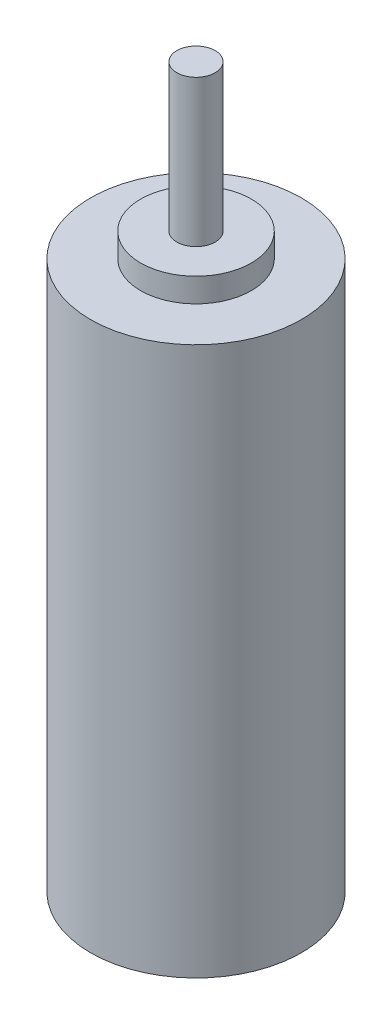
from build123d import *

# Parameters (mm, degrees)
SKETCH1_R           = 11
BOSS_EXTRUDE1_DEPTH = 57.2
SKETCH2_R           = 5.776092572
BOSS_EXTRUDE2_DEPTH = 2.5
SKETCH3_R           = 2
BOSS_EXTRUDE3_DEPTH = 15.3


with BuildPart() as part:
    # Sketch1 → Boss-Extrude1 (new body)
    with BuildSketch(Plane(origin=(0, 0, 0), x_dir=(1, 0, 0), z_dir=(0, 1, 0))):
        with Locations(Location((0, 0, 0), (0, 0, 270))):
            Circle(SKETCH1_R)
    extrude(amount=BOSS_EXTRUDE1_DEPTH)

    # Sketch2 → Boss-Extrude2 (add)
    with BuildSketch(Plane(origin=(0, 57.2, 0), x_dir=(1, 0, 0), z_dir=(0, 1, 0))):
        with Locations(Location((0, 0, 0), (0, 0, 270))):
            Circle(SKETCH2_R)
    extrude(amount=BOSS_EXTRUDE2_DEPTH)

    # Sketch3 → Boss-Extrude3 (add)
    with BuildSketch(Plane(origin=(0, 59.7, 0), x_dir=(1, 0, 0), z_dir=(0, 1, 0))):
        with Locations(Location((0, 0, 0), (0, 0, 270))):
            Circle(SKETCH3_R)
    extrude(amount=BOSS_EXTRUDE3_DEPTH)


solid = part.part
